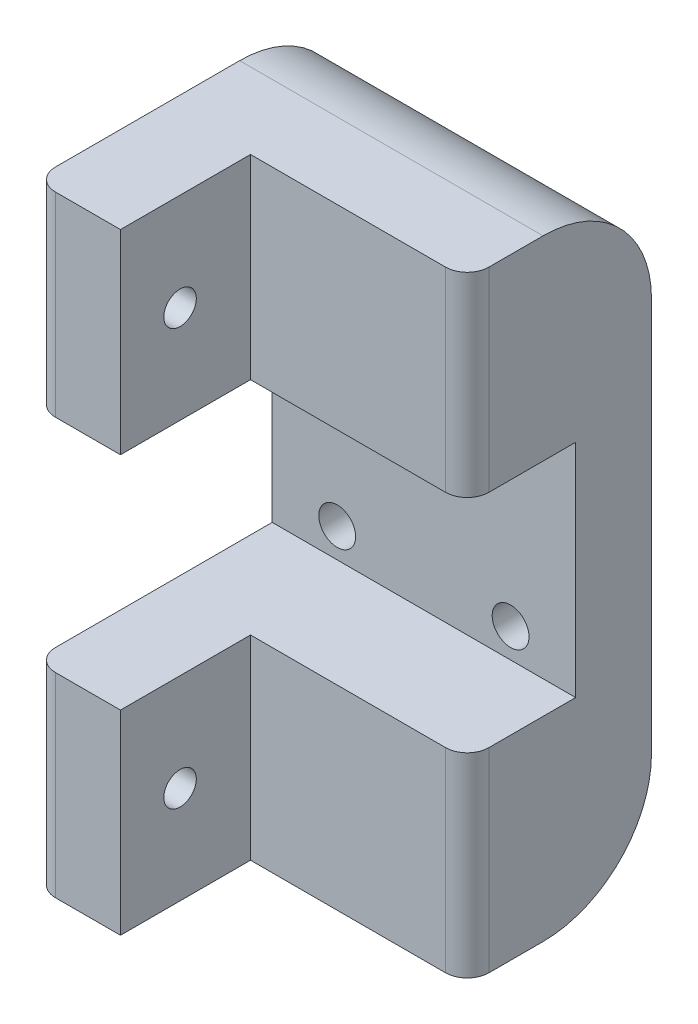
from build123d import *

# Parameters (mm, degrees)
SKETCH_2_W                = 28
SKETCH_2_H                = 20.4
EXTRUDE_2_DEPTH           = 7
SKETCH_5_W                = 28
SKETCH_5_H                = 17
EXTRUDE_3_DEPTH           = 18
SKETCH_6_W                = 28
SKETCH_6_H                = 17
EXTRUDE_4_DEPTH           = 18
HOLE_WIZARD_2_D           = 3.4
HOLE_WIZARD_2_CSINK_D     = 6.6
HOLE_WIZARD_2_CSINK_ANGLE = 90
FILLET_1_R                = 10
SKETCH_18_W               = 8
SKETCH_18_H               = 18
EXTRUDE_5_DEPTH           = 12
SKETCH_19_R               = 1.5
CUT_EXTRUDE_6_DEPTH       = 56.673692171
FILLET_2_R                = 2


with BuildPart() as part:
    # 草图2 → 凸台-拉伸2 (new body)
    with BuildSketch(Plane.XY):
        with Locations((14, 10.2)):
            Rectangle(SKETCH_2_W, SKETCH_2_H)
    extrude(amount=EXTRUDE_2_DEPTH)

    # 草图5 → 凸台-拉伸3 (add)
    with BuildSketch(Plane(origin=(0, 20.4, 0), x_dir=(1, 0, 0), z_dir=(0, 1, 0))):
        with Locations((14, -8.5)):
            Rectangle(SKETCH_5_W, SKETCH_5_H)
    extrude(amount=EXTRUDE_3_DEPTH)

    # 草图6 → 凸台-拉伸4 (add)
    with BuildSketch(Plane.XZ):
        with Locations((14, 8.5)):
            Rectangle(SKETCH_6_W, SKETCH_6_H)
    extrude(amount=EXTRUDE_4_DEPTH)

    # 打孔尺寸(%根据十字)槽半沉头木螺钉的类型2 (through all)
    with Locations(Plane(origin=(0, 0, 0), x_dir=(-1, 0, 0), z_dir=(0, 0, -1))):
        with Locations((-22, 17.7), (-6, 17.7), (-6, 2.7), (-22, 2.7)):
            CounterSinkHole(HOLE_WIZARD_2_D / 2, HOLE_WIZARD_2_CSINK_D / 2, counter_sink_angle=HOLE_WIZARD_2_CSINK_ANGLE)

    # 圆角1
    fillet_1_edges = [part.edges().sort_by_distance(p)[0] for p in [
        (14, 38.4, 0),
        (14, -18, 0),
    ]]
    fillet(fillet_1_edges, radius=FILLET_1_R)

    # 草图18 → 凸台-拉伸5 (add)
    with BuildSketch(Plane.XY.offset(17)):
        with Locations((4, 29.4)):
            Rectangle(SKETCH_18_W, SKETCH_18_H)
        with Locations((4, -9)):
            Rectangle(SKETCH_18_W, SKETCH_18_H)
    extrude(amount=EXTRUDE_5_DEPTH)

    # 草图19 → 切除-拉伸6 (cut, through all)
    with BuildSketch(Plane.ZY):
        with Locations((23.5, 29.4)):
            Circle(SKETCH_19_R)
        with Locations((23.5, -9)):
            Circle(SKETCH_19_R)
    extrude(amount=-CUT_EXTRUDE_6_DEPTH, mode=Mode.SUBTRACT)

    # 圆角2
    fillet_2_edges = [part.edges().sort_by_distance(p)[0] for p in [
        (28, 29.4, 17),
        (28, -9, 17),
        (0, 29.4, 29),
        (0, -9, 29),
    ]]
    fillet(fillet_2_edges, radius=FILLET_2_R)


solid = part.part
